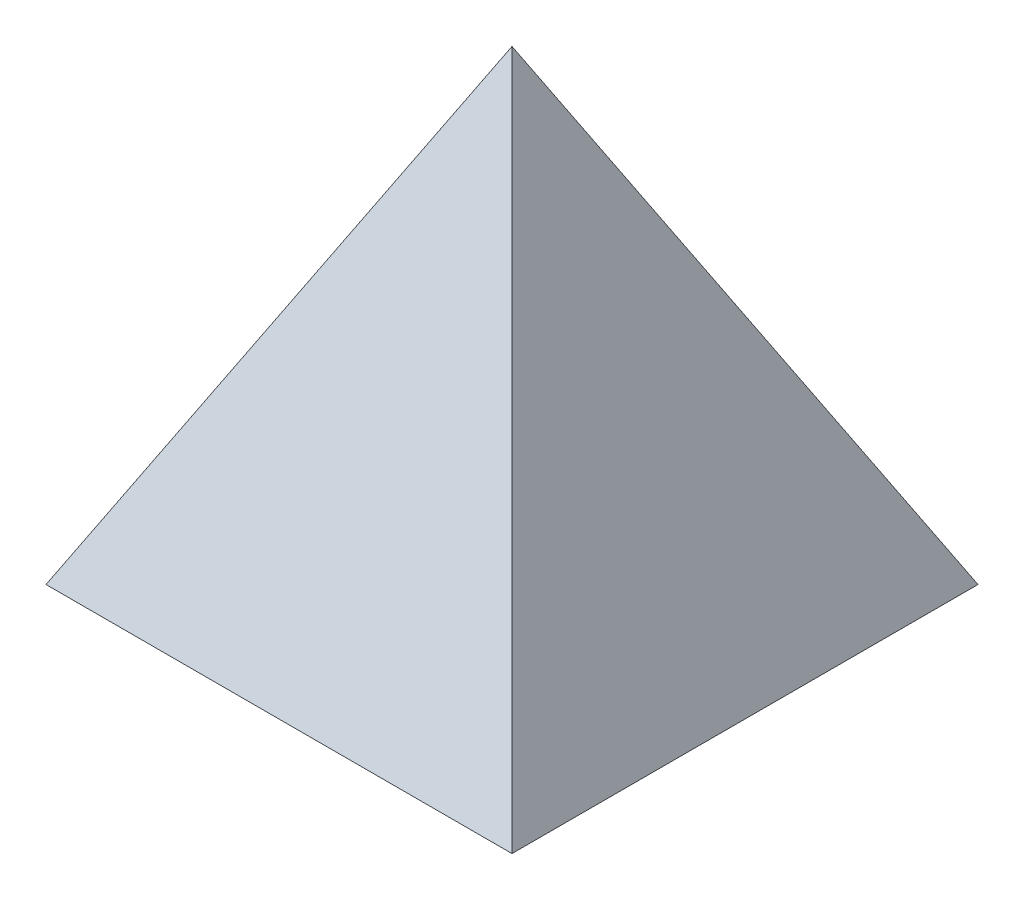
from build123d import *

# Parameters (mm, degrees)
SKETCH1_W           = 0.6
SKETCH1_H           = 0.6
BOSS_EXTRUDE1_DEPTH = 0.6
CUT_EXTRUDE1_DEPTH  = 0.6
CUT_EXTRUDE4_DEPTH  = 0.6


with BuildPart() as part:
    # Sketch1 → Boss-Extrude1 (new body)
    with BuildSketch(Plane(origin=(0, 0, 0), x_dir=(1, 0, 0), z_dir=(0, 1, 0))):
        with Locations((0.3, 0.3)):
            Rectangle(SKETCH1_W, SKETCH1_H)
    extrude(amount=BOSS_EXTRUDE1_DEPTH)

    # Sketch2 → Cut-Extrude1 (cut)
    with BuildSketch(Plane.XY):
        Polygon((0, 0.6), (0.3, 0.6), (0, 0), align=None)
        Polygon((0.3, 0.6), (0.6, 0.6), (0.6, 0), align=None)
    extrude(amount=-CUT_EXTRUDE1_DEPTH, mode=Mode.SUBTRACT)

    # Sketch3 → Cut-Extrude4 (cut)
    with BuildSketch(Plane(origin=(0, 0, 0), x_dir=(0, 0, -1), z_dir=(1, 0, 0))):
        Polygon((0.6, 0.6), (0.6, 0), (0.3, 0.6), align=None)
        Polygon((0, 0.6), (0.3, 0.6), (0, 0), align=None)
    extrude(amount=CUT_EXTRUDE4_DEPTH, mode=Mode.SUBTRACT)


solid = part.part
